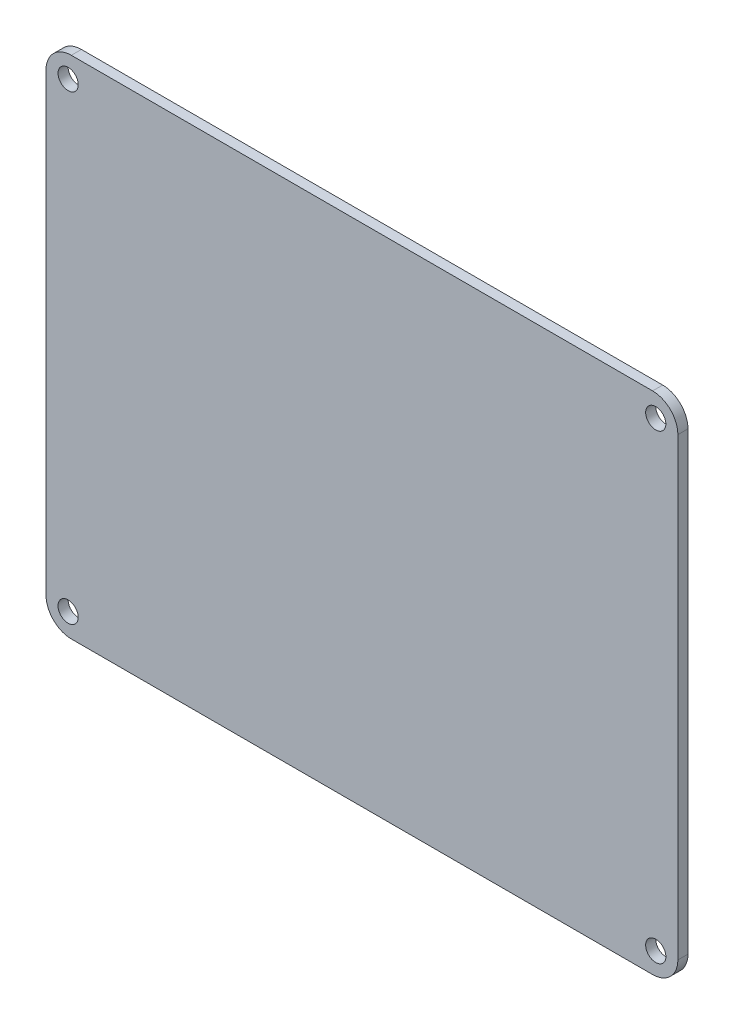
from build123d import *

# Parameters (mm, degrees)
SKETCH1_R           = 1.6
BOSS_EXTRUDE1_DEPTH = 1.6


with BuildPart() as part:
    # Sketch1 → Boss-Extrude1 (new body)
    with BuildSketch(Plane.XY):
        with BuildLine():
            Line((46, -40), (-46, -40))
            ThreePointArc((-46, -40), (-48.828427125, -38.828427125), (-50, -36))
            Line((-50, -36), (-50, 36))
            ThreePointArc((-50, 36), (-48.828427125, 38.828427125), (-46, 40))
            Line((-46, 40), (46, 40))
            ThreePointArc((46, 40), (48.828427125, 38.828427125), (50, 36))
            Line((50, 36), (50, -36))
            ThreePointArc((50, -36), (48.828427125, -38.828427125), (46, -40))
        make_face()
        with Locations((-46.5, 36.5)):
            Circle(SKETCH1_R, mode=Mode.SUBTRACT)
        with Locations((-46.5, -36.5)):
            Circle(SKETCH1_R, mode=Mode.SUBTRACT)
        with Locations((46.5, -36.5)):
            Circle(SKETCH1_R, mode=Mode.SUBTRACT)
        with Locations((46.5, 36.5)):
            Circle(SKETCH1_R, mode=Mode.SUBTRACT)
    extrude(amount=BOSS_EXTRUDE1_DEPTH)


solid = part.part
